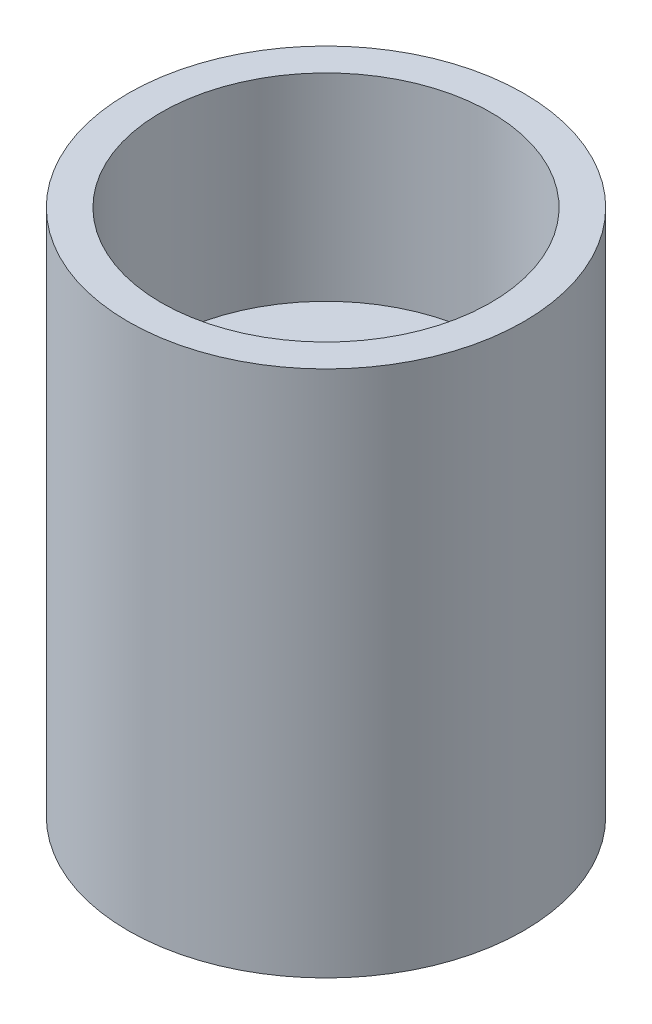
from build123d import *

# Parameters (mm, degrees)
SKETCH1_R           = 3
BOSS_EXTRUDE1_DEPTH = 8
SKETCH2_R           = 2.5
CUT_EXTRUDE1_DEPTH  = 3
CUT_EXTRUDE2_START  = -3
SKETCH3_R           = 2.5
CUT_EXTRUDE2_DEPTH  = 3


with BuildPart() as part:
    # Sketch1 → Boss-Extrude1 (new body)
    with BuildSketch(Plane(origin=(0, 0, 0), x_dir=(1, 0, 0), z_dir=(0, 1, 0))):
        with Locations(Location((0, 0, 0), (0, 0, 270))):
            Circle(SKETCH1_R)
    extrude(amount=BOSS_EXTRUDE1_DEPTH)

    # Sketch2 → Cut-Extrude1 (cut)
    with BuildSketch(Plane(origin=(0, 8, 0), x_dir=(1, 0, 0), z_dir=(0, 1, 0))):
        with Locations(Location((0, 0, 0), (0, 0, 270))):
            Circle(SKETCH2_R)
    extrude(amount=-CUT_EXTRUDE1_DEPTH, mode=Mode.SUBTRACT)

    # Sketch3 → Cut-Extrude2 (cut)
    with BuildSketch(Plane.XZ.offset(CUT_EXTRUDE2_START)):
        with Locations(Location((0, 0, 0), (0, 0, 90))):
            Circle(SKETCH3_R)
    extrude(amount=CUT_EXTRUDE2_DEPTH, mode=Mode.SUBTRACT)


solid = part.part
